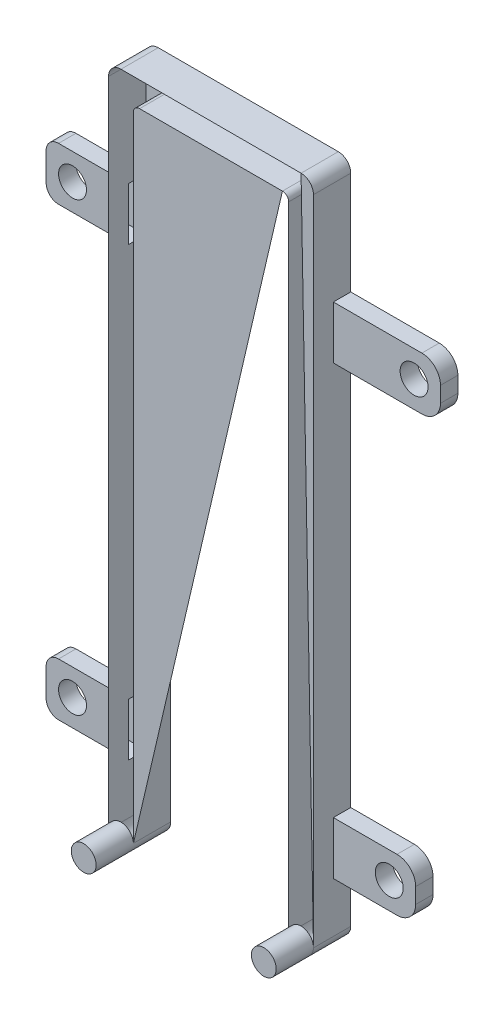
from build123d import *

# Parameters (mm, degrees)
SKICA1_R                   = 2.25
P_IDAT_VYSUNUT_M10_DEPTH   = 2.8
P_IDAT_VYSUNUT_M10_2_DEPTH = 2.8
P_IDAT_VYSUNUT_M10_3_DEPTH = 2.8
P_IDAT_VYSUNUT_M10_4_DEPTH = 2.8
P_IDAT_VYSUNUT_M11_DEPTH   = 6
SKICA8_R                   = 2.000336871
SKICA8_R_2                 = 2
P_IDAT_VYSUNUT_M12_DEPTH   = 6


with BuildPart() as part:
    # Skica1 → Přidat vysunutím10 (new body)
    with BuildSketch(Plane.XY):
        with BuildLine():
            Line((-15.25, 10), (-4, 10))
            Line((-4, 10), (-4, 18.5))
            Line((-4, 18.5), (-15.25, 18.5))
            ThreePointArc((-15.25, 18.5), (-16.664213562, 17.914213562), (-17.25, 16.5))
            Line((-17.25, 16.5), (-17.25, 12))
            ThreePointArc((-17.25, 12), (-16.664213562, 10.585786438), (-15.25, 10))
        make_face()
        with Locations((-13, 14.25)):
            Circle(SKICA1_R, mode=Mode.SUBTRACT)
    extrude(amount=P_IDAT_VYSUNUT_M10_DEPTH)



with BuildPart() as body_2:
    # Skica1 → P_idat vysunut_m10 2 (new body)
    with BuildSketch(Plane.XY):
        with BuildLine():
            Line((-15.25, 81.9), (-4, 81.9))
            Line((-4, 81.9), (-4, 90.4))
            Line((-4, 90.4), (-15.25, 90.4))
            ThreePointArc((-15.25, 90.4), (-16.664213562, 89.814213562), (-17.25, 88.4))
            Line((-17.25, 88.4), (-17.25, 83.9))
            ThreePointArc((-17.25, 83.9), (-16.664213562, 82.485786438), (-15.25, 81.9))
        make_face()
        with Locations((-13, 86.15)):
            Circle(SKICA1_R, mode=Mode.SUBTRACT)
    extrude(amount=P_IDAT_VYSUNUT_M10_2_DEPTH)


with BuildPart() as body_3:
    # Skica1 → P_idat vysunut_m10 3 (new body)
    with BuildSketch(Plane.XY):
        with BuildLine():
            Line((29, 18.5), (29, 10))
            Line((29, 10), (39.25, 10))
            ThreePointArc((39.25, 10), (41.371320344, 10.878679656), (42.25, 13))
            Line((42.25, 13), (42.25, 15.5))
            ThreePointArc((42.25, 15.5), (41.371320344, 17.621320344), (39.25, 18.5))
            Line((39.25, 18.5), (29, 18.5))
        make_face()
        with Locations((38, 14.25)):
            Circle(SKICA1_R, mode=Mode.SUBTRACT)
    extrude(amount=P_IDAT_VYSUNUT_M10_3_DEPTH)


with BuildPart() as body_4:
    # Skica1 → P_idat vysunut_m10 4 (new body)
    with BuildSketch(Plane.XY):
        with BuildLine():
            Line((43.25, 90.4), (29, 90.4))
            Line((29, 90.4), (29, 81.9))
            Line((29, 81.9), (43.25, 81.9))
            ThreePointArc((43.25, 81.9), (45.371320344, 82.778679656), (46.25, 84.9))
            Line((46.25, 84.9), (46.25, 87.4))
            ThreePointArc((46.25, 87.4), (45.371320344, 89.521320344), (43.25, 90.4))
        make_face()
        with Locations((42, 86.15)):
            Circle(SKICA1_R, mode=Mode.SUBTRACT)
    extrude(amount=P_IDAT_VYSUNUT_M10_4_DEPTH)


with BuildPart() as part_1:
    add(part.part)

    add(body_2.part)  # Přidat vysunutím11 merges body 2

    add(body_3.part)  # Přidat vysunutím11 merges body 3

    add(body_4.part)  # Přidat vysunutím11 merges body 4
    # Skica1<20> → Přidat vysunutím11 (add)
    with BuildSketch(Plane.XY):
        with BuildLine():
            Line((-4, 10), (-4, 1.926580778))
            ThreePointArc((-4, 1.926580778), (-1.963290389, -0.036709611), (0, 2))
            Line((0, 2), (0, 104))
            ThreePointArc((0, 104), (0.305319351, 104.683259003), (0.999325975, 104.963290389))
            Line((0.999325975, 104.963290389), (24, 104.963290389))
            ThreePointArc((24, 104.963290389), (24.707106781, 104.67039717), (25, 103.963290389))
            Line((25, 103.963290389), (25, 2))
            ThreePointArc((25, 2), (26.963290389, -0.036709611), (29, 1.926580778))
            Line((29, 1.926580778), (29, 10))
            Line((29, 10), (29, 18.5))
            Line((29, 18.5), (29, 81.9))
            Line((29, 81.9), (29, 90.4))
            Line((29, 90.4), (29, 106.963290389))
            ThreePointArc((29, 106.963290389), (28.414213562, 108.377503951), (27, 108.963290389))
            Line((27, 108.963290389), (-2, 108.963290389))
            ThreePointArc((-2, 108.963290389), (-3.414213562, 108.377503951), (-4, 106.963290389))
            Line((-4, 106.963290389), (-4, 90.4))
            Line((-4, 90.4), (-4, 81.9))
            Line((-4, 81.9), (-4, 18.5))
            Line((-4, 18.5), (-4, 10))
        make_face()
    extrude(amount=P_IDAT_VYSUNUT_M11_DEPTH)

    # Skica8 → Přidat vysunutím12 (add)
    with BuildSketch(Plane.XY.offset(6)):
        with Locations((-2, 1.963290389)):
            Circle(SKICA8_R)
        with Locations((27, 1.963290389)):
            Circle(SKICA8_R_2)
    extrude(amount=P_IDAT_VYSUNUT_M12_DEPTH)


solid = part_1.part
